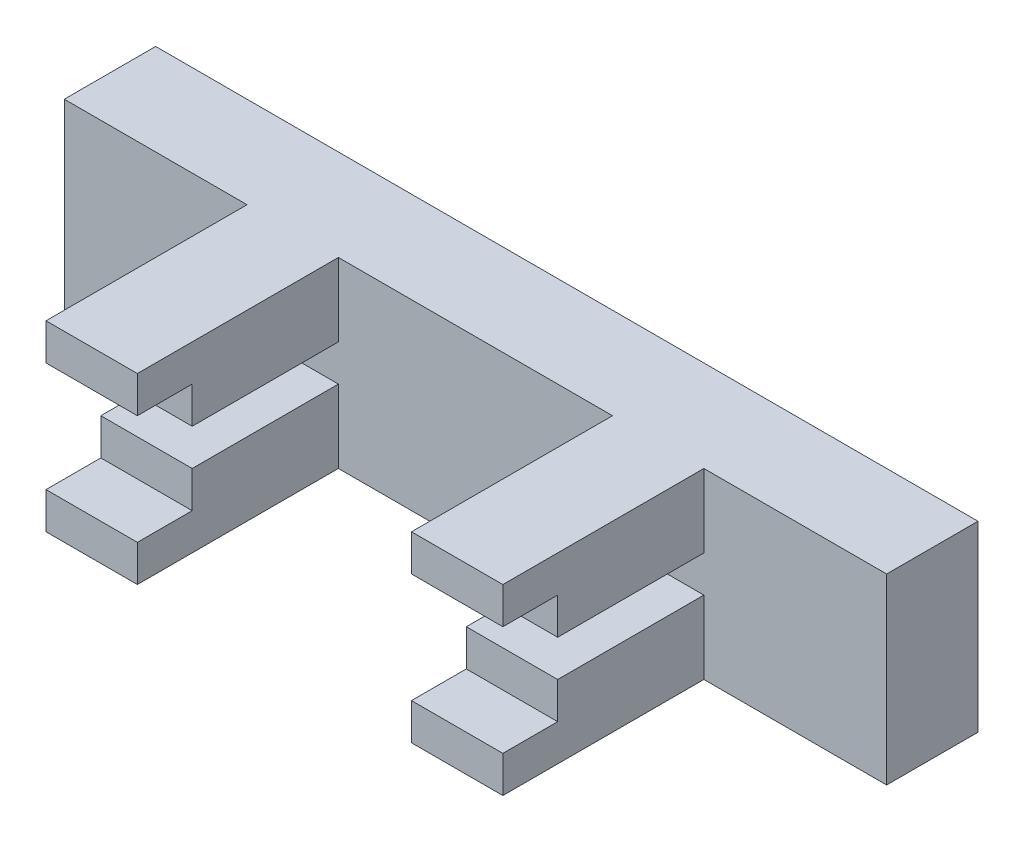
from build123d import *

# Parameters (mm, degrees)
SKETCH_1_W          = 45
SKETCH_1_H          = 10
EXTRUDE_1_DEPTH     = 5
SKETCH_2_W          = 5
SKETCH_2_H          = 4
EXTRUDE_2_DEPTH     = 11
SKETCH_3_W          = 5
SKETCH_3_H          = 2
CUT_EXTRUDE_1_DEPTH = 3
SKETCH_4_W          = 5
SKETCH_4_H          = 2
CUT_EXTRUDE_2_DEPTH = 3
SKETCH_7_W          = 5
SKETCH_7_H          = 4
EXTRUDE_3_DEPTH     = 11
SKETCH_8_W          = 5
SKETCH_8_H          = 2
CUT_EXTRUDE_5_DEPTH = 3
SKETCH_9_W          = 5
SKETCH_9_H          = 2
CUT_EXTRUDE_6_DEPTH = 3


with BuildPart() as part:
    # Эскиз1 → Бобышка-Вытянуть1 (new body)
    with BuildSketch(Plane.XY):
        Rectangle(SKETCH_1_W, SKETCH_1_H)
    extrude(amount=EXTRUDE_1_DEPTH)

    # Эскиз2 → Бобышка-Вытянуть2 (add)
    with BuildSketch(Plane.XY.offset(5)):
        with Locations((-10, 3)):
            Rectangle(SKETCH_2_W, SKETCH_2_H)
        with Locations((10, 3)):
            Rectangle(SKETCH_2_W, SKETCH_2_H)
    extrude(amount=EXTRUDE_2_DEPTH)

    # Эскиз3 → Вырез-Вытянуть1 (cut)
    with BuildSketch(Plane.XY.offset(16)):
        with Locations((-10, 2)):
            Rectangle(SKETCH_3_W, SKETCH_3_H)
    extrude(amount=-CUT_EXTRUDE_1_DEPTH, mode=Mode.SUBTRACT)

    # Эскиз4 → Вырез-Вытянуть2 (cut)
    with BuildSketch(Plane.XY.offset(16)):
        with Locations((10, 2)):
            Rectangle(SKETCH_4_W, SKETCH_4_H)
    extrude(amount=-CUT_EXTRUDE_2_DEPTH, mode=Mode.SUBTRACT)

    # Эскиз7 → Бобышка-Вытянуть3 (add)
    with BuildSketch(Plane.XY.offset(5)):
        with Locations((-10, -3)):
            Rectangle(SKETCH_7_W, SKETCH_7_H)
        with Locations((10, -3)):
            Rectangle(SKETCH_7_W, SKETCH_7_H)
    extrude(amount=EXTRUDE_3_DEPTH)

    # Эскиз8 → Вырез-Вытянуть5 (cut)
    with BuildSketch(Plane.XY.offset(16)):
        with Locations((-10, -2)):
            Rectangle(SKETCH_8_W, SKETCH_8_H)
    extrude(amount=-CUT_EXTRUDE_5_DEPTH, mode=Mode.SUBTRACT)

    # Эскиз9 → Вырез-Вытянуть6 (cut)
    with BuildSketch(Plane.XY.offset(16)):
        with Locations((10, -2)):
            Rectangle(SKETCH_9_W, SKETCH_9_H)
    extrude(amount=-CUT_EXTRUDE_6_DEPTH, mode=Mode.SUBTRACT)


solid = part.part
